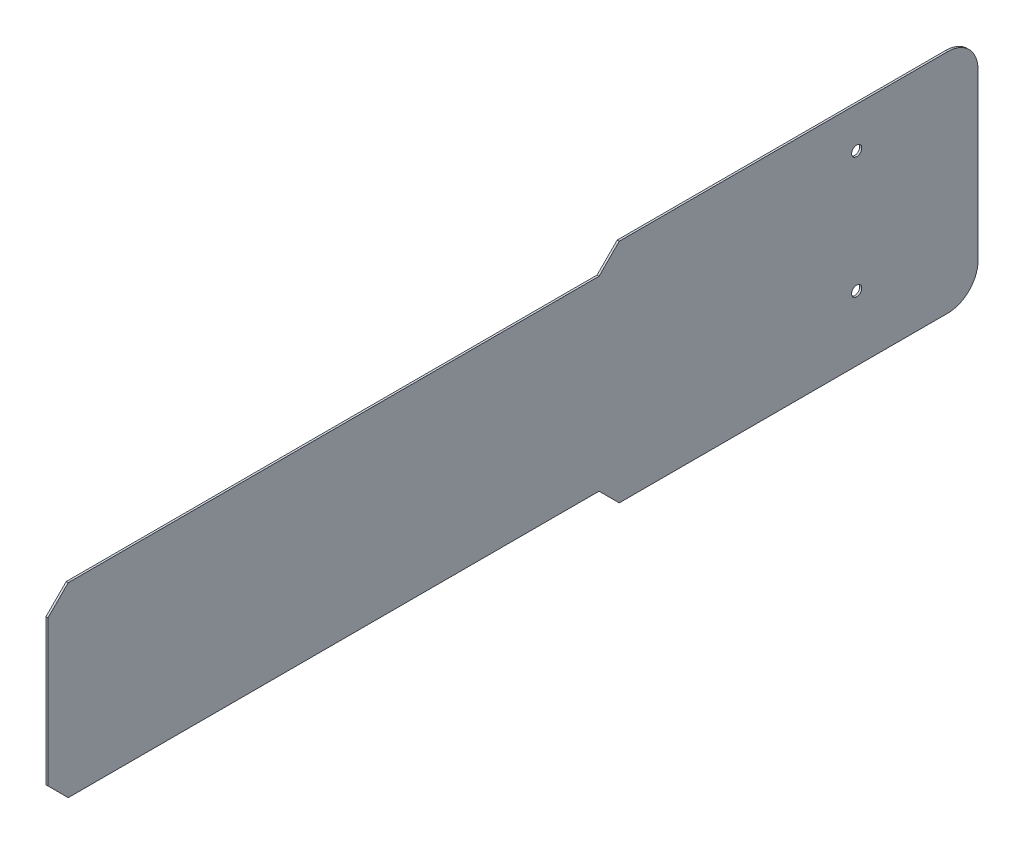
from build123d import *

# Parameters (mm, degrees)
SKETCH2_W           = 22.42
SKETCH2_H           = 92
BOSS_EXTRUDE2_DEPTH = 0.2
FILLET4_R           = 3
FILLET7_R           = 3
SKETCH4_W           = 2
SKETCH4_H           = 54.51
CUT_EXTRUDE1_DEPTH  = 0.2
SKETCH5_W           = 2
SKETCH5_H           = 54.51
CUT_EXTRUDE2_DEPTH  = 0.2
CUT_EXTRUDE3_DEPTH  = 0.2
CUT_EXTRUDE4_DEPTH  = 0.2
CUT_EXTRUDE7_DEPTH  = 0.2
CUT_EXTRUDE8_DEPTH  = 0.2
SKETCH13_R          = 0.5
CUT_EXTRUDE12_DEPTH = 10
SKETCH15_R          = 0.5
CUT_EXTRUDE13_DEPTH = 0.2


with BuildPart() as part:
    # Sketch2 → Boss-Extrude2 (new body)
    with BuildSketch(Plane(origin=(0, 0, 0), x_dir=(0, 1, 0), z_dir=(-1, 0, 0))):
        with Locations((-43.813076923, -17.338461538)):
            Rectangle(SKETCH2_W, SKETCH2_H)
    extrude(amount=BOSS_EXTRUDE2_DEPTH)

    # Fillet4
    fillet4_edges = [part.edges().sort_by_distance(p)[0] for p in [
        (-0.1, -55.023076923, -28.661538462),
    ]]
    fillet(fillet4_edges, radius=FILLET4_R)

    # Fillet7
    fillet7_edges = [part.edges().sort_by_distance(p)[0] for p in [
        (-0.1, -32.603076923, -28.661538462),
    ]]
    fillet(fillet7_edges, radius=FILLET7_R)

    # Sketch4 → Cut-Extrude1 (cut)
    with BuildSketch(Plane(origin=(-0.2, 0, 0), x_dir=(0, 1, 0), z_dir=(-1, 0, 0))):
        with Locations((-54.023076923, -36.083461538)):
            Rectangle(SKETCH4_W, SKETCH4_H)
    extrude(amount=-CUT_EXTRUDE1_DEPTH, mode=Mode.SUBTRACT)

    # Sketch5 → Cut-Extrude2 (cut)
    with BuildSketch(Plane(origin=(-0.2, 0, 0), x_dir=(0, 1, 0), z_dir=(-1, 0, 0))):
        with Locations((-33.603076923, -36.083461538)):
            Rectangle(SKETCH5_W, SKETCH5_H)
    extrude(amount=-CUT_EXTRUDE2_DEPTH, mode=Mode.SUBTRACT)

    # Sketch6 → Cut-Extrude3 (cut)
    with BuildSketch(Plane(origin=(-0.2, 0, 0), x_dir=(0, 1, 0), z_dir=(-1, 0, 0))):
        Polygon((-53.023076923, -63.338461538), (-53.023076923, -61.338461538), (-51.023076923, -63.338461538), align=None)
    extrude(amount=-CUT_EXTRUDE3_DEPTH, mode=Mode.SUBTRACT)

    # Sketch7 → Cut-Extrude4 (cut)
    with BuildSketch(Plane(origin=(-0.2, 0, 0), x_dir=(0, 1, 0), z_dir=(-1, 0, 0))):
        Polygon((-34.603076923, -63.338461538), (-34.603076923, -61.338461538), (-36.603076923, -63.338461538), align=None)
    extrude(amount=-CUT_EXTRUDE4_DEPTH, mode=Mode.SUBTRACT)

    # Sketch8 → Cut-Extrude7 (cut)
    with BuildSketch(Plane(origin=(-0.2, 0, 0), x_dir=(0, 1, 0), z_dir=(-1, 0, 0))):
        Polygon((-53.023076923, -8.828461538), (-55.023076923, -8.828461538), (-55.023076923, -6.828461538), align=None)
    extrude(amount=-CUT_EXTRUDE7_DEPTH, mode=Mode.SUBTRACT)

    # Sketch9 → Cut-Extrude8 (cut)
    with BuildSketch(Plane(origin=(-0.2, 0, 0), x_dir=(0, 1, 0), z_dir=(-1, 0, 0))):
        Polygon((-34.603076923, -8.828461538), (-32.603076923, -8.828461538), (-32.603076923, -6.828461538), align=None)
    extrude(amount=-CUT_EXTRUDE8_DEPTH, mode=Mode.SUBTRACT)

    # Sketch13 → Cut-Extrude12 (cut)
    with BuildSketch(Plane(origin=(-0.2, 0, 0), x_dir=(0, 1, 0), z_dir=(-1, 0, 0))):
        with Locations(Location((-48.603076923, 16.661538462, 0), (0, 0, 180))):
            Circle(SKETCH13_R)
    extrude(amount=-CUT_EXTRUDE12_DEPTH, mode=Mode.SUBTRACT)

    # Sketch15 → Cut-Extrude13 (cut)
    with BuildSketch(Plane(origin=(-0.2, 0, 0), x_dir=(0, 1, 0), z_dir=(-1, 0, 0))):
        with Locations(Location((-36.603076923, 16.661538462, 0), (0, 0, 180))):
            Circle(SKETCH15_R)
    extrude(amount=-CUT_EXTRUDE13_DEPTH, mode=Mode.SUBTRACT)


solid = part.part
